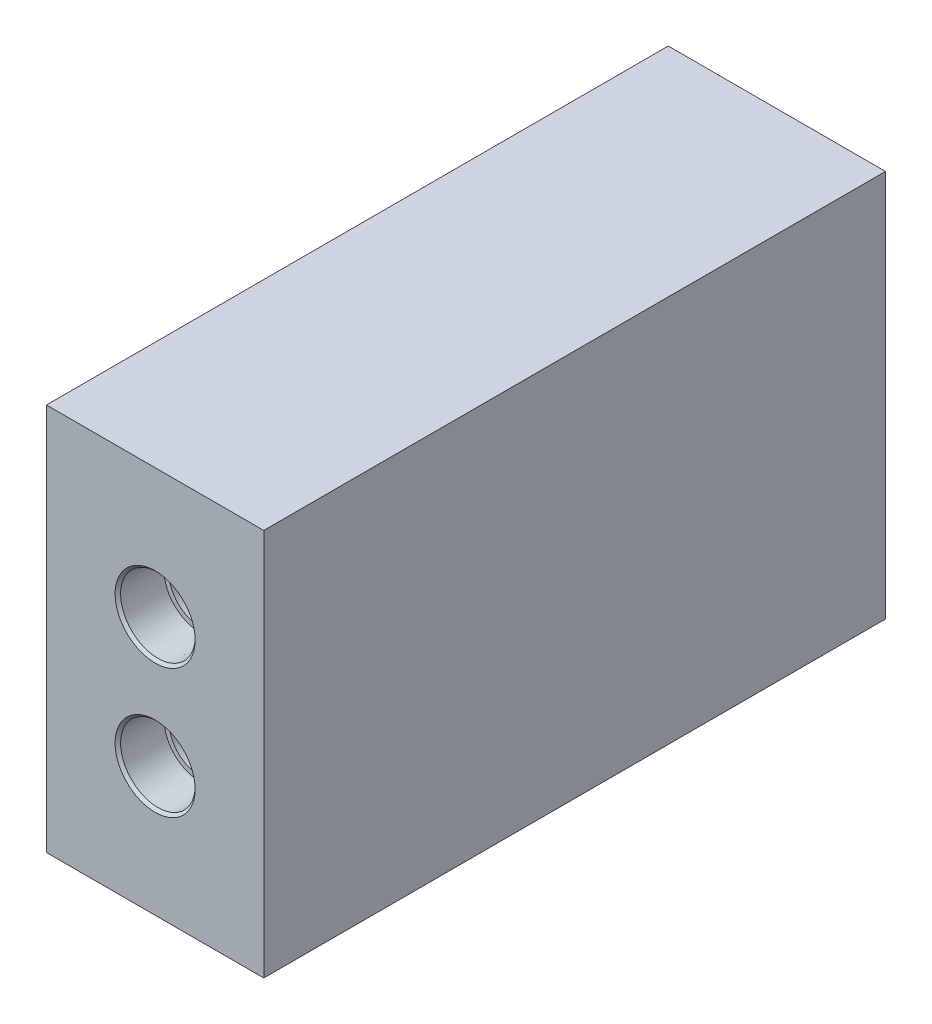
from build123d import *

# Parameters (mm, degrees)
BLOCK_SKETCH_W                                 = 143.078580116
BLOCK_SKETCH_H                                 = 89.193835888
BLOCK_DEPTH                                    = 25
F_1_8_NPT_PRESSURE_SENSOR_CONNECTOR_AT_2_COUNT = 2
F_1_8_NPT_PRESSURE_SENSOR_CONNECTOR_AT_2_PITCH = 77.105121067
F_1_8_NPT_PRESSURE_SENSOR_CONNECTOR_AT_3_COUNT = 2
F_1_8_NPT_PRESSURE_SENSOR_CONNECTOR_AT_3_PITCH = 82.638663007
F_1_8_NPT_PRESSURE_SENSOR_CONNECTOR_AT_4_COUNT = 2
F_1_8_NPT_PRESSURE_SENSOR_CONNECTOR_AT_4_PITCH = 29.731278629
F_3_8_NPT_FLOW_CONNECTOR_AT_2_COUNT            = 2
F_3_8_NPT_FLOW_CONNECTOR_AT_2_PITCH            = 29.731278629
FLOW_CHANNEL_AT_2_COUNT                        = 2
FLOW_CHANNEL_AT_2_PITCH                        = 29.731278629
PRESSURE_SENSOR_HOLE_REACH                     = 107.46
SKETCH11_R                                     = 1.6
M8X1_0_TAPPED_HOLE1_D                          = 7
M10X1_0_TAPPED_HOLE1_D                         = 9


with BuildPart() as part:
    # block_sketch → block (new, symmetric)
    with BuildSketch(Plane(origin=(0, 0, 0), x_dir=(0, 0, -1), z_dir=(1, 0, 0))):
        Rectangle(BLOCK_SKETCH_W, BLOCK_SKETCH_H)
    extrude(amount=BLOCK_DEPTH, both=True)

    # Sketch4 → 1/8 NPT_pressure_sensor_connector (revolve, cut)
    with BuildSketch(Plane(origin=(-25, -14.865639315, 38.552560533), x_dir=(0, 0, 1), z_dir=(0, 1, 0))):
        Polygon((0, 0), (0, 14.153468714), (4.2164, 11.62), (4.2164, 6.92), (4.955191683, 6.92), (5.143373, 0.635), (5.778373, 0), align=None)
    f_1_8_npt_pressure_sensor_connector = revolve(axis=Axis((-31.35, -14.865639315, 38.552560533), (1, 0, 0)), mode=Mode.SUBTRACT)

    # 1/8 NPT_pressure_sensor_connector at 2: 1/8 NPT_pressure_sensor_connector ×2
    with Locations(*[(0, 0, -i * F_1_8_NPT_PRESSURE_SENSOR_CONNECTOR_AT_2_PITCH) for i in range(1, F_1_8_NPT_PRESSURE_SENSOR_CONNECTOR_AT_2_COUNT)]):
        add(f_1_8_npt_pressure_sensor_connector, mode=Mode.SUBTRACT)

    # 1/8 NPT_pressure_sensor_connector at 3: 1/8 NPT_pressure_sensor_connector ×2
    with Locations(*[Vector(0, 0.3597744390752151, -0.9330393094549202) * (i * F_1_8_NPT_PRESSURE_SENSOR_CONNECTOR_AT_3_PITCH) for i in range(1, F_1_8_NPT_PRESSURE_SENSOR_CONNECTOR_AT_3_COUNT)]):
        add(f_1_8_npt_pressure_sensor_connector, mode=Mode.SUBTRACT)

    # 1/8 NPT_pressure_sensor_connector at 4: 1/8 NPT_pressure_sensor_connector ×2
    with Locations(*[(0, i * F_1_8_NPT_PRESSURE_SENSOR_CONNECTOR_AT_4_PITCH, 0) for i in range(1, F_1_8_NPT_PRESSURE_SENSOR_CONNECTOR_AT_4_COUNT)]):
        add(f_1_8_npt_pressure_sensor_connector, mode=Mode.SUBTRACT)

    # Sketch6 → 3/8 NPT_flow_connector (revolve, cut)
    with BuildSketch(Plane(origin=(0, 14.865639315, 71.539290058), x_dir=(0, -1, 0), z_dir=(1, 0, 0))):
        Polygon((0, 0), (0, 21.668582582), (7.1374, 17.38), (7.1374, 10.33), (8.282218717, 10.33), (8.5725, 0.635), (9.2075, 0), align=None)
    f_3_8_npt_flow_connector = revolve(axis=Axis((0, 14.865639315, 77.889290058), (0, 0, -1)), mode=Mode.SUBTRACT)

    # 3/8 NPT_flow_connector at 2: 3/8 NPT_flow_connector ×2
    with Locations(*[(0, -i * F_3_8_NPT_FLOW_CONNECTOR_AT_2_PITCH, 0) for i in range(1, F_3_8_NPT_FLOW_CONNECTOR_AT_2_COUNT)]):
        add(f_3_8_npt_flow_connector, mode=Mode.SUBTRACT)

    # Sketch15 → flow_channel (revolve, cut)
    with BuildSketch(Plane(origin=(0, 14.865639315, 71.539290058), x_dir=(0, -1, 0), z_dir=(1, 0, 0))):
        Polygon((0, 0), (0, 43.815464931), (6.35, 40), (6.35, 0), align=None)
    flow_channel = revolve(axis=Axis((0, 14.865639315, 77.889290058), (0, 0, -1)), mode=Mode.SUBTRACT)

    # flow_channel at 2: flow_channel ×2
    with Locations(*[(0, -i * FLOW_CHANNEL_AT_2_PITCH, 0) for i in range(1, FLOW_CHANNEL_AT_2_COUNT)]):
        add(flow_channel, mode=Mode.SUBTRACT)

    # flow_mirror: 3/8 NPT_flow_connector, flow_channel across plane
    add(f_3_8_npt_flow_connector.mirror(Plane.XY), mode=Mode.SUBTRACT)
    add(flow_channel.mirror(Plane.XY), mode=Mode.SUBTRACT)

    # flow_mirror copy 1 sketch → flow_mirror copy 1 (revolve, cut)
    with BuildSketch(Plane(origin=(0, -14.865639315, -71.539290058), x_dir=(0, -1, 0), z_dir=(1, 0, 0))):
        Polygon((0, 0), (0, -21.668582582), (7.1374, -17.38), (7.1374, -10.33), (8.282218717, -10.33), (8.5725, -0.635), (9.2075, 0), align=None)
    revolve(axis=Axis((0, -14.865639315, -77.889290058), (0, 0, -1)), mode=Mode.SUBTRACT)

    # flow_mirror copy 2 sketch → flow_mirror copy 2 (revolve, cut)
    with BuildSketch(Plane(origin=(0, -14.865639315, -71.539290058), x_dir=(0, -1, 0), z_dir=(1, 0, 0))):
        Polygon((0, 0), (0, -43.815464931), (6.35, -40), (6.35, 0), align=None)
    revolve(axis=Axis((0, -14.865639315, -77.889290058), (0, 0, -1)), mode=Mode.SUBTRACT)

    # Sketch11 → pressure_sensor_hole (cut, up to next)
    with BuildSketch(Plane(origin=(-25, 14.596917944, 0), x_dir=(0, -1, 0), z_dir=(1, 0, 0)), mode=Mode.PRIVATE) as pressure_sensor_hole_sk1:
        with Locations(Location((29.462557259, 38.552560533, 0), (0, 0, 270))):
            Circle(SKETCH11_R)
    pressure_sensor_hole_tool1 = extrude(pressure_sensor_hole_sk1.sketch, amount=PRESSURE_SENSOR_HOLE_REACH, mode=Mode.PRIVATE) & part.part
    # Sketch11 → pressure_sensor_hole (cut, up to next)
    with BuildSketch(Plane(origin=(-25, 14.596917944, 0), x_dir=(0, -1, 0), z_dir=(1, 0, 0)), mode=Mode.PRIVATE) as pressure_sensor_hole_sk2:
        with Locations(Location((29.462557259, -38.552560533, 0), (0, 0, 270))):
            Circle(SKETCH11_R)
    pressure_sensor_hole_tool2 = extrude(pressure_sensor_hole_sk2.sketch, amount=PRESSURE_SENSOR_HOLE_REACH, mode=Mode.PRIVATE) & part.part
    # Sketch11 → pressure_sensor_hole (cut, up to next)
    with BuildSketch(Plane(origin=(-25, 14.596917944, 0), x_dir=(0, -1, 0), z_dir=(1, 0, 0)), mode=Mode.PRIVATE) as pressure_sensor_hole_sk3:
        with Locations(Location((-0.268721371, 38.552560533, 0), (0, 0, 270))):
            Circle(SKETCH11_R)
    pressure_sensor_hole_tool3 = extrude(pressure_sensor_hole_sk3.sketch, amount=PRESSURE_SENSOR_HOLE_REACH, mode=Mode.PRIVATE) & part.part
    # Sketch11 → pressure_sensor_hole (cut, up to next)
    with BuildSketch(Plane(origin=(-25, 14.596917944, 0), x_dir=(0, -1, 0), z_dir=(1, 0, 0)), mode=Mode.PRIVATE) as pressure_sensor_hole_sk4:
        with Locations(Location((-0.268721371, -38.552560533, 0), (0, 0, 270))):
            Circle(SKETCH11_R)
    pressure_sensor_hole_tool4 = extrude(pressure_sensor_hole_sk4.sketch, amount=PRESSURE_SENSOR_HOLE_REACH, mode=Mode.PRIVATE) & part.part
    add(pressure_sensor_hole_tool1.solids().sort_by_distance((-25, -14.865639, -38.552561))[0], mode=Mode.SUBTRACT)
    add(pressure_sensor_hole_tool2.solids().sort_by_distance((-25, -14.865639, 38.552561))[0], mode=Mode.SUBTRACT)
    add(pressure_sensor_hole_tool3.solids().sort_by_distance((-25, 14.865639, -38.552561))[0], mode=Mode.SUBTRACT)
    add(pressure_sensor_hole_tool4.solids().sort_by_distance((-25, 14.865639, 38.552561))[0], mode=Mode.SUBTRACT)

    # M8x1.0 Tapped Hole1 (through all)
    with Locations(Plane.XY.offset(71.539290058)):
        with Locations((0, -14.865639315)):
            Hole(M8X1_0_TAPPED_HOLE1_D / 2)

    # M10x1.0 Tapped Hole1 (through all)
    with Locations(Plane.XY.offset(71.539290058)):
        with Locations((0, 14.865639315)):
            Hole(M10X1_0_TAPPED_HOLE1_D / 2)


solid = part.part
